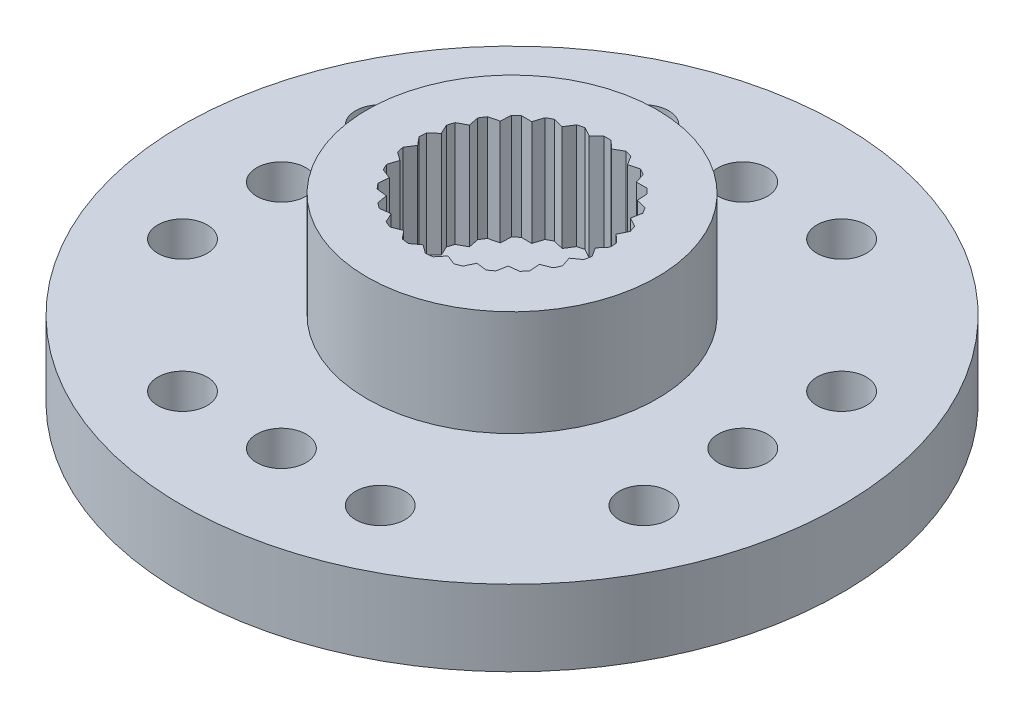
from build123d import *

# Parameters (mm, degrees)
SKETCH1_W                      = 10
SKETCH1_H                      = 2.3
SKETCH2_R                      = 4.4
BOSS_EXTRUDE1_DEPTH            = 3.2
CUT_EXTRUDE1_DEPTH             = 3.2
F_1_5_1_5_DIAMETER_HOLE1_D     = 1.5
F_1_5_1_5_DIAMETER_HOLE1_DEPTH = 5.5
F_3_0_3_DIAMETER_HOLE1_D       = 3
F_3_0_3_DIAMETER_HOLE1_DEPTH   = 5.5


with BuildPart() as part:
    # Sketch1 → Revolve1 (revolve)
    with BuildSketch(Plane.XY, mode=Mode.PRIVATE) as revolve1_sk:
        with Locations((5, 0)):
            Rectangle(SKETCH1_W, SKETCH1_H)
    revolve(revolve1_sk.sketch.rotate(Axis((0, 1.15, 0), (0, -1, 0)), 270), axis=Axis((0, 1.15, 0), (0, -1, 0)))

    # Sketch2 → Boss-Extrude1 (add)
    with BuildSketch(Plane(origin=(0, 1.15, 0), x_dir=(-1, 0, 0), z_dir=(0, 1, 0))):
        with Locations(Location((0, 0, 0), (0, 0, 270))):
            Circle(SKETCH2_R)
    extrude(amount=BOSS_EXTRUDE1_DEPTH)

    # Sketch3 → Cut-Extrude1 (cut)
    with BuildSketch(Plane(origin=(0, 4.35, 0), x_dir=(-1, 0, 0), z_dir=(0, 1, 0))):
        with BuildLine():
            Line((-0.61665913, -2.83367809), (-0.338399731, -2.678709694))
            Line((-0.338399731, -2.678709694), (-0.107421435, -2.898009771))
            ThreePointArc((-0.107421435, -2.898009771), (0, -2.9), (0.107421435, -2.898009771))
            Line((0.107421435, -2.898009771), (0.338399731, -2.678709694))
            Line((0.338399731, -2.678709694), (0.61665913, -2.83367809))
            ThreePointArc((0.61665913, -2.83367809), (0.721200673, -2.808891167), (0.824752316, -2.780248841))
            Line((0.824752316, -2.780248841), (0.993936292, -2.510396512))
            Line((0.993936292, -2.510396512), (1.301992734, -2.591295993))
            ThreePointArc((1.301992734, -2.591295993), (1.397085655, -2.541289372), (1.490260976, -2.48779465))
            Line((1.490260976, -2.48779465), (1.587020181, -2.184345885))
            Line((1.587020181, -2.184345885), (1.905517346, -2.186093238))
            ThreePointArc((1.905517346, -2.186093238), (1.985186607, -2.11400902), (2.062131058, -2.039023173))
            Line((2.062131058, -2.039023173), (2.080385755, -1.721044772))
            Line((2.080385755, -1.721044772), (2.389311295, -1.643530205))
            ThreePointArc((2.389311295, -1.643530205), (2.448550984, -1.553897705), (2.504429862, -1.46213237))
            Line((2.504429862, -1.46213237), (2.443033042, -1.149604087))
            Line((2.443033042, -1.149604087), (2.722976028, -0.997698125))
            ThreePointArc((2.722976028, -0.997698125), (2.758063897, -0.896149284), (2.789366126, -0.793370413))
            Line((2.789366126, -0.793370413), (2.652175577, -0.505929549))
            Line((2.652175577, -0.505929549), (2.885546163, -0.289177003))
            ThreePointArc((2.885546163, -0.289177003), (2.894277512, -0.182092507), (2.899036259, -0.074758075))
            Line((2.899036259, -0.074758075), (2.694672167, 0.169534403))
            Line((2.694672167, 0.169534403), (2.866806821, 0.437514174))
            ThreePointArc((2.866806821, 0.437514174), (2.848633027, 0.543405812), (2.826549281, 0.648551587))
            Line((2.826549281, 0.648551587), (2.567852594, 0.834345885))
            Line((2.567852594, 0.834345885), (2.667935462, 1.136714727))
            ThreePointArc((2.667935462, 1.136714727), (2.623998452, 1.234759946), (2.576459817, 1.331110368))
            Line((2.576459817, 1.331110368), (2.279685399, 1.446732346))
            Line((2.279685399, 1.446732346), (2.301427906, 1.764491312))
            ThreePointArc((2.301427906, 1.764491312), (2.234488404, 1.84852957), (2.164481907, 1.930030589))
            Line((2.164481907, 1.930030589), (1.848277186, 1.968215294))
            Line((1.848277186, 1.968215294), (1.790313171, 2.281398419))
            ThreePointArc((1.790313171, 2.281398419), (1.704577232, 2.346149284), (1.616501638, 2.40767989))
            Line((1.616501638, 2.40767989), (1.30073492, 2.366028036))
            Line((1.30073492, 2.366028036), (1.166706475, 2.654956874))
            ThreePointArc((1.166706475, 2.654956874), (1.067561203, 2.696351809), (0.966950626, 2.734045809))
            Line((0.966950626, 2.734045809), (0.671462695, 2.615174535))
            Line((0.671462695, 2.615174535), (0.469791321, 2.861694623))
            ThreePointArc((0.469791321, 2.861694623), (0.363466377, 2.877132634), (0.25664255, 2.888621575))
            Line((0.25664255, 2.888621575), (0, 2.7))
            Line((0, 2.7), (-0.25664255, 2.888621575))
            ThreePointArc((-0.25664255, 2.888621575), (-0.363466377, 2.877132634), (-0.469791321, 2.861694623))
            Line((-0.469791321, 2.861694623), (-0.671462695, 2.615174535))
            Line((-0.671462695, 2.615174535), (-0.966950626, 2.734045809))
            ThreePointArc((-0.966950626, 2.734045809), (-1.067561203, 2.696351809), (-1.166706475, 2.654956874))
            Line((-1.166706475, 2.654956874), (-1.30073492, 2.366028036))
            Line((-1.30073492, 2.366028036), (-1.616501638, 2.40767989))
            ThreePointArc((-1.616501638, 2.40767989), (-1.704577232, 2.346149284), (-1.790313171, 2.281398419))
            Line((-1.790313171, 2.281398419), (-1.848277186, 1.968215294))
            Line((-1.848277186, 1.968215294), (-2.164481907, 1.930030589))
            ThreePointArc((-2.164481907, 1.930030589), (-2.234488404, 1.84852957), (-2.301427906, 1.764491312))
            Line((-2.301427906, 1.764491312), (-2.279685399, 1.446732346))
            Line((-2.279685399, 1.446732346), (-2.576459817, 1.331110368))
            ThreePointArc((-2.576459817, 1.331110368), (-2.623998452, 1.234759946), (-2.667935462, 1.136714727))
            Line((-2.667935462, 1.136714727), (-2.567852594, 0.834345885))
            Line((-2.567852594, 0.834345885), (-2.826549281, 0.648551587))
            ThreePointArc((-2.826549281, 0.648551587), (-2.848633027, 0.543405812), (-2.866806821, 0.437514174))
            Line((-2.866806821, 0.437514174), (-2.694672167, 0.169534403))
            Line((-2.694672167, 0.169534403), (-2.899036259, -0.074758075))
            ThreePointArc((-2.899036259, -0.074758075), (-2.894277512, -0.182092507), (-2.885546163, -0.289177003))
            Line((-2.885546163, -0.289177003), (-2.652175577, -0.505929549))
            Line((-2.652175577, -0.505929549), (-2.789366126, -0.793370413))
            ThreePointArc((-2.789366126, -0.793370413), (-2.758063897, -0.896149284), (-2.722976028, -0.997698125))
            Line((-2.722976028, -0.997698125), (-2.443033042, -1.149604087))
            Line((-2.443033042, -1.149604087), (-2.504429862, -1.46213237))
            ThreePointArc((-2.504429862, -1.46213237), (-2.448550984, -1.553897705), (-2.389311295, -1.643530205))
            Line((-2.389311295, -1.643530205), (-2.080385755, -1.721044772))
            Line((-2.080385755, -1.721044772), (-2.062131058, -2.039023173))
            ThreePointArc((-2.062131058, -2.039023173), (-1.985186607, -2.11400902), (-1.905517346, -2.186093238))
            Line((-1.905517346, -2.186093238), (-1.587020181, -2.184345885))
            Line((-1.587020181, -2.184345885), (-1.490260976, -2.48779465))
            ThreePointArc((-1.490260976, -2.48779465), (-1.397085655, -2.541289372), (-1.301992734, -2.591295993))
            Line((-1.301992734, -2.591295993), (-0.993936292, -2.510396512))
            Line((-0.993936292, -2.510396512), (-0.824752316, -2.780248841))
            ThreePointArc((-0.824752316, -2.780248841), (-0.721200673, -2.808891167), (-0.61665913, -2.83367809))
        make_face()
    extrude(amount=-CUT_EXTRUDE1_DEPTH, mode=Mode.SUBTRACT)

    # Ø1.5 (1.5) Diameter Hole1
    with Locations(Plane(origin=(0, -1.15, 0), x_dir=(-1, 0, 0), z_dir=(0, -1, 0))):
        with Locations((0, 7), (3, 7), (-3, 7), (-7, 0), (-7, 3), (-7, -3), (0, -7), (-3, -7), (3, -7), (7, 0), (7, -3), (7, 3)):
            Hole(F_1_5_1_5_DIAMETER_HOLE1_D / 2, depth=F_1_5_1_5_DIAMETER_HOLE1_DEPTH)

    # Ø3.0 (3) Diameter Hole1
    with Locations(Plane(origin=(0, -1.15, 0), x_dir=(-1, 0, 0), z_dir=(0, -1, 0))):
        with Locations((0, 0)):
            Hole(F_3_0_3_DIAMETER_HOLE1_D / 2, depth=F_3_0_3_DIAMETER_HOLE1_DEPTH)


solid = part.part
